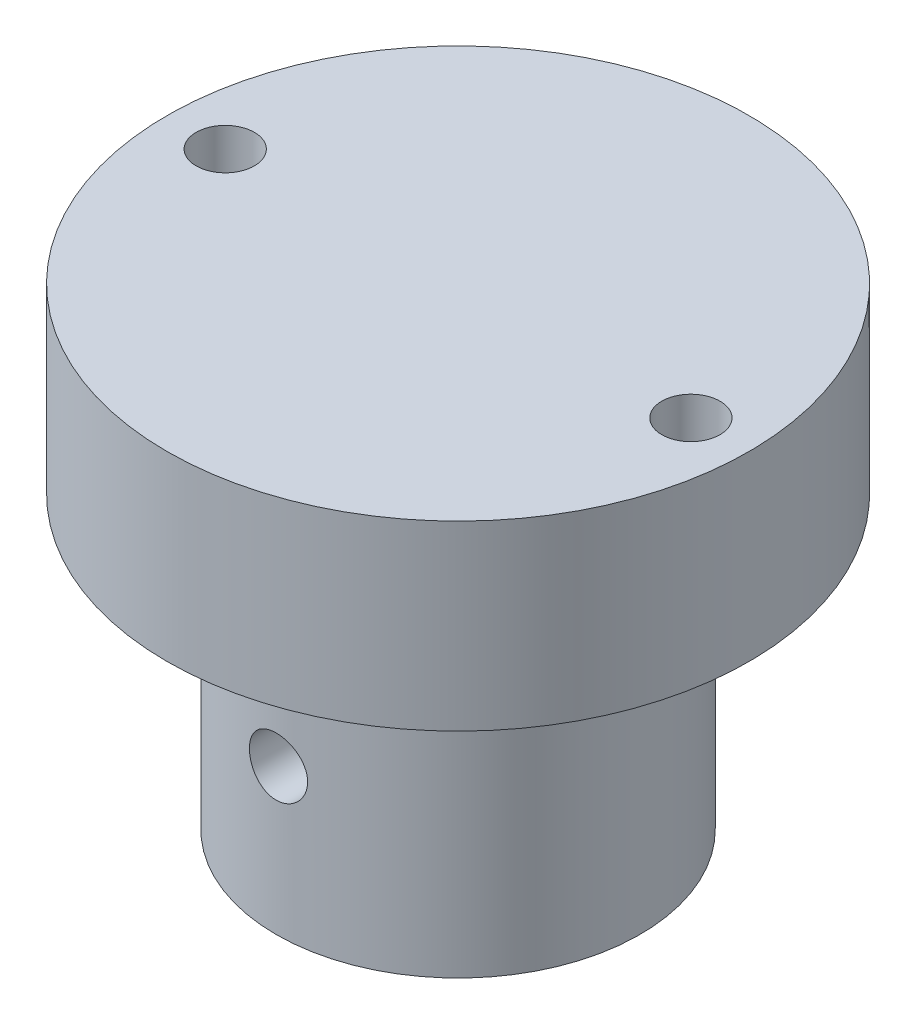
from build123d import *

# Parameters (mm, degrees)
SKETCH1_R                           = 6.35
BOSS_EXTRUDE1_DEPTH                 = 10.16
SKETCH2_R                           = 4.7625
CUT_EXTRUDE2_DEPTH                  = 10.16
SKETCH3_R                           = 6.35
BOSS_EXTRUDE2_DEPTH                 = 6.35
CUT_EXTRUDE3_REACH                  = 20.794
CUT_EXTRUDE3_END_RADIUS             = 6.35
SKETCH4_R                           = 1.016
CUT_EXTRUDE3_DIRECTION_2_REACH      = 20.794
CUT_EXTRUDE3_DIRECTION_2_END_RADIUS = 6.35
BOSS_EXTRUDE3_START                 = -6.35
SKETCH5_R                           = 10.16
SKETCH5_R_2                         = 6.35
BOSS_EXTRUDE3_DEPTH                 = 6.35
SKETCH10_R                          = 1.016
CUT_EXTRUDE4_DEPTH                  = 6.35


with BuildPart() as part:
    # Sketch1 → Boss-Extrude1 (new body)
    with BuildSketch(Plane(origin=(0, 0, 0), x_dir=(1, 0, 0), z_dir=(0, 1, 0))):
        with Locations(Location((0, 0, 0), (0, 0, 270))):
            Circle(SKETCH1_R)
    extrude(amount=BOSS_EXTRUDE1_DEPTH)

    # Sketch2 → Cut-Extrude2 (cut)
    with BuildSketch(Plane(origin=(0, 10.16, 0), x_dir=(1, 0, 0), z_dir=(0, 1, 0))):
        with Locations(Location((0, 0, 0), (0, 0, 270))):
            Circle(SKETCH2_R)
    extrude(amount=-CUT_EXTRUDE2_DEPTH, mode=Mode.SUBTRACT)

    # Sketch3 → Boss-Extrude2 (add)
    with BuildSketch(Plane(origin=(0, 10.16, 0), x_dir=(1, 0, 0), z_dir=(0, 1, 0))):
        with Locations(Location((0, 0, 0), (0, 0, 270))):
            Circle(SKETCH3_R)
    extrude(amount=BOSS_EXTRUDE2_DEPTH)

    # Cut-Extrude3: up to this cylinder (the profile starts inside it)
    cut_extrude3_end = Plane(origin=(0, 5.08, 0), z_dir=(0, -1, 0)) * Cylinder(CUT_EXTRUDE3_END_RADIUS, 55.288, mode=Mode.PRIVATE)
    # Sketch4 → Cut-Extrude3 (cut, up to the surface)
    with BuildSketch(Plane.XY, mode=Mode.PRIVATE) as cut_extrude3_sk1:
        with Locations((0, 5.08)):
            Circle(SKETCH4_R)
    cut_extrude3_tool1 = extrude(cut_extrude3_sk1.sketch, amount=-CUT_EXTRUDE3_REACH, mode=Mode.PRIVATE) & cut_extrude3_end
    add(cut_extrude3_tool1.solids().sort_by_distance((0, 5.08, 0))[0], mode=Mode.SUBTRACT)

    # Cut-Extrude3 direction 2: up to this cylinder (the profile starts inside it)
    cut_extrude3_direction_2_end = Plane(origin=(0, 5.08, 0), z_dir=(0, -1, 0)) * Cylinder(CUT_EXTRUDE3_DIRECTION_2_END_RADIUS, 55.288, mode=Mode.PRIVATE)
    # Sketch4 → Cut-Extrude3 direction 2 (cut, up to the surface)
    with BuildSketch(Plane.XY, mode=Mode.PRIVATE) as cut_extrude3_direction_2_sk1:
        with Locations((0, 5.08)):
            Circle(SKETCH4_R)
    cut_extrude3_direction_2_tool1 = extrude(cut_extrude3_direction_2_sk1.sketch, amount=CUT_EXTRUDE3_DIRECTION_2_REACH, mode=Mode.PRIVATE) & cut_extrude3_direction_2_end
    add(cut_extrude3_direction_2_tool1.solids().sort_by_distance((0, 5.08, 0))[0], mode=Mode.SUBTRACT)

    # Sketch5 → Boss-Extrude3 (add)
    with BuildSketch(Plane(origin=(0, 16.51, 0), x_dir=(1, 0, 0), z_dir=(0, 1, 0)).offset(BOSS_EXTRUDE3_START)):
        with Locations(Location((0, 0, 0), (0, 0, 270))):
            Circle(SKETCH5_R)
        with Locations(Location((0, 0, 0), (0, 0, 270))):
            Circle(SKETCH5_R_2, mode=Mode.SUBTRACT)
    extrude(amount=BOSS_EXTRUDE3_DEPTH)

    # Sketch10 → Cut-Extrude4 (cut)
    with BuildSketch(Plane(origin=(0, 16.51, 0), x_dir=(1, 0, 0), z_dir=(0, 1, 0))):
        with Locations(Location((8.128, 0, 0), (0, 0, 270))):
            Circle(SKETCH10_R)
        with Locations(Location((-8.128, 0, 0), (0, 0, 270))):
            Circle(SKETCH10_R)
    extrude(amount=-CUT_EXTRUDE4_DEPTH, mode=Mode.SUBTRACT)


solid = part.part
